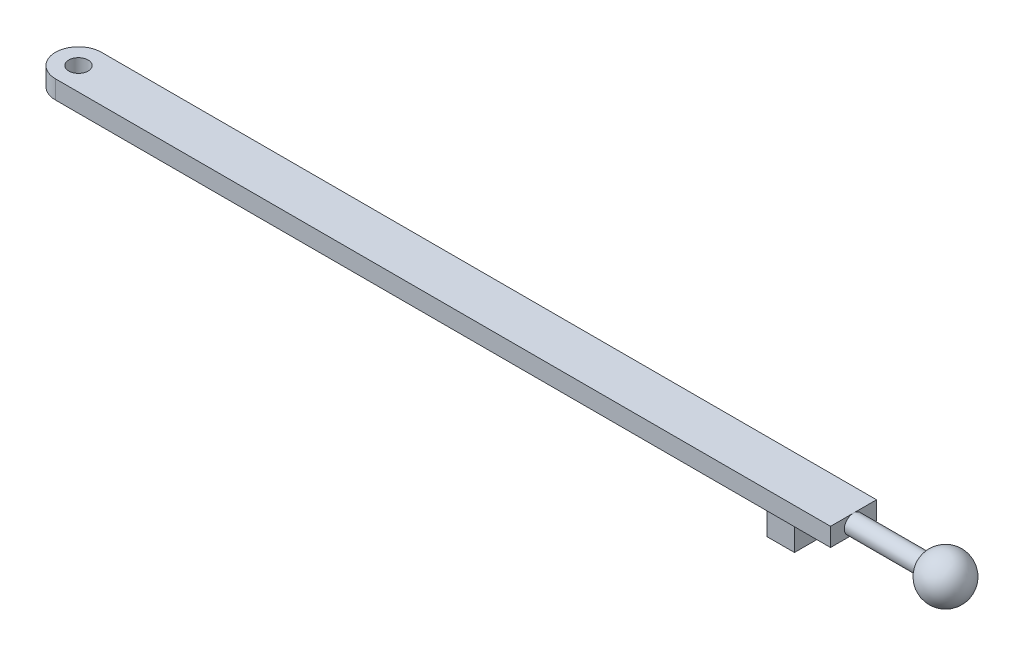
from build123d import *

# Parameters (mm, degrees)
SKETCH1_R               = 1
BOSS_EXTRUDE1_DEPTH     = 2
SKETCH4_R               = 1
BOSS_EXTRUDE2_DEPTH     = 11
SKETCH11_W              = 0.548452347
SKETCH11_H              = 0.731269796
BOSS_EXTRUDE3_DEPTH     = 1
SKETCH12_W              = 2.985960681
SKETCH12_H              = 2.799338139
BOSS_EXTRUDE4_DEPTH     = 3
SKETCH15_W              = 5
SKETCH15_H              = 2
BOSS_EXTRUDE5_DEPTH     = 86.79
CUT_EXTRUDE4_DEPTH      = 87.918088451
CUT_EXTRUDE4_DEPTH_BACK = 87.918088451
CUT_EXTRUDE5_DEPTH      = 88.033063258
CUT_EXTRUDE5_DEPTH_BACK = 88.033063258
SKETCH19_R              = 1.05
CUT_EXTRUDE7_DEPTH      = 87.918088451
CUT_EXTRUDE7_DEPTH_BACK = 87.918088451


with BuildPart() as part:
    # Sketch1 → Boss-Extrude1 (new body)
    with BuildSketch(Plane(origin=(0, 0, 0), x_dir=(1, 0, 0), z_dir=(0, 1, 0))):
        with BuildLine():
            Line((-10, 2.5), (0, 2.5))
            Line((0, 2.5), (0, -2.5))
            Line((0, -2.5), (-10, -2.5))
            ThreePointArc((-10, -2.5), (-12.5, 0), (-10, 2.5))
        make_face()
        with Locations((-10, 0)):
            Circle(SKETCH1_R, mode=Mode.SUBTRACT)
    extrude(amount=BOSS_EXTRUDE1_DEPTH)

    # Sketch4 → Boss-Extrude2 (add)
    with BuildSketch(Plane(origin=(0, 0, 0), x_dir=(0, 0, -1), z_dir=(1, 0, 0))):
        with Locations((0, 1)):
            Circle(SKETCH4_R)
    extrude(amount=BOSS_EXTRUDE2_DEPTH)

    # Sketch11 → Boss-Extrude3 (add)
    with BuildSketch(Plane.XZ):
        with Locations((-7.723091918, 0.104467114)):
            Rectangle(SKETCH11_W, SKETCH11_H)
    extrude(amount=BOSS_EXTRUDE3_DEPTH)

    # Sketch12 → Boss-Extrude4 (add)
    with BuildSketch(Plane.XZ.offset(1)):
        with Locations((-6.985405351, -0.467965971)):
            Rectangle(SKETCH12_W, SKETCH12_H)
    extrude(amount=BOSS_EXTRUDE4_DEPTH)

    # Sketch15 → Boss-Extrude5 (add)
    with BuildSketch(Plane(origin=(0, 0, 0), x_dir=(0, 0, -1), z_dir=(1, 0, 0))):
        with Locations((0, 1)):
            Rectangle(SKETCH15_W, SKETCH15_H)
    extrude(amount=-BOSS_EXTRUDE5_DEPTH)

    # Sketch16 → Cut-Extrude4 (cut, two sides: drawn at the far end of the back side and taken through both)
    with BuildSketch(Plane.XZ.offset(-CUT_EXTRUDE4_DEPTH_BACK)):
        with BuildLine():
            ThreePointArc((-84.29, -2.5), (-86.057766953, -1.767766953), (-86.79, 0))
            Line((-86.79, 0), (-86.79, -2.5))
            Line((-86.79, -2.5), (-84.29, -2.5))
        make_face()
    extrude(amount=CUT_EXTRUDE4_DEPTH + CUT_EXTRUDE4_DEPTH_BACK, mode=Mode.SUBTRACT)

    # Sketch19 → Cut-Extrude5 (cut, two sides: drawn at the far end of the back side and taken through both)
    with BuildSketch(Plane(origin=(0, 2, 0), x_dir=(1, 0, 0), z_dir=(0, 1, 0)).offset(-CUT_EXTRUDE5_DEPTH_BACK)):
        with Locations((-84.29, 0)):
            Circle(SKETCH19_R)
    extrude(amount=CUT_EXTRUDE5_DEPTH + CUT_EXTRUDE5_DEPTH_BACK, mode=Mode.SUBTRACT)

    # Sketch16<4> → Cut-Extrude7 (cut, two sides: drawn at the far end of the back side and taken through both)
    with BuildSketch(Plane.XZ.offset(-CUT_EXTRUDE7_DEPTH_BACK)):
        with BuildLine():
            Line((-86.79, 2.5), (-86.79, 0))
            ThreePointArc((-86.79, 0), (-86.057766953, 1.767766953), (-84.29, 2.5))
            Line((-84.29, 2.5), (-86.79, 2.5))
        make_face()
    extrude(amount=CUT_EXTRUDE7_DEPTH + CUT_EXTRUDE7_DEPTH_BACK, mode=Mode.SUBTRACT)

    # Sketch22 → Revolve2 (revolve)
    with BuildSketch(Plane(origin=(0, 1, 0), x_dir=(-1, 0, 0), z_dir=(0, -1, 0))):
        with BuildLine():
            Line((-7.5, 0), (-12.5, 0))
            ThreePointArc((-12.5, 0), (-10, -2.5), (-7.5, 0))
        make_face()
    revolve(axis=Axis((12.5, 1, 0), (-1, 0, 0)))


solid = part.part
